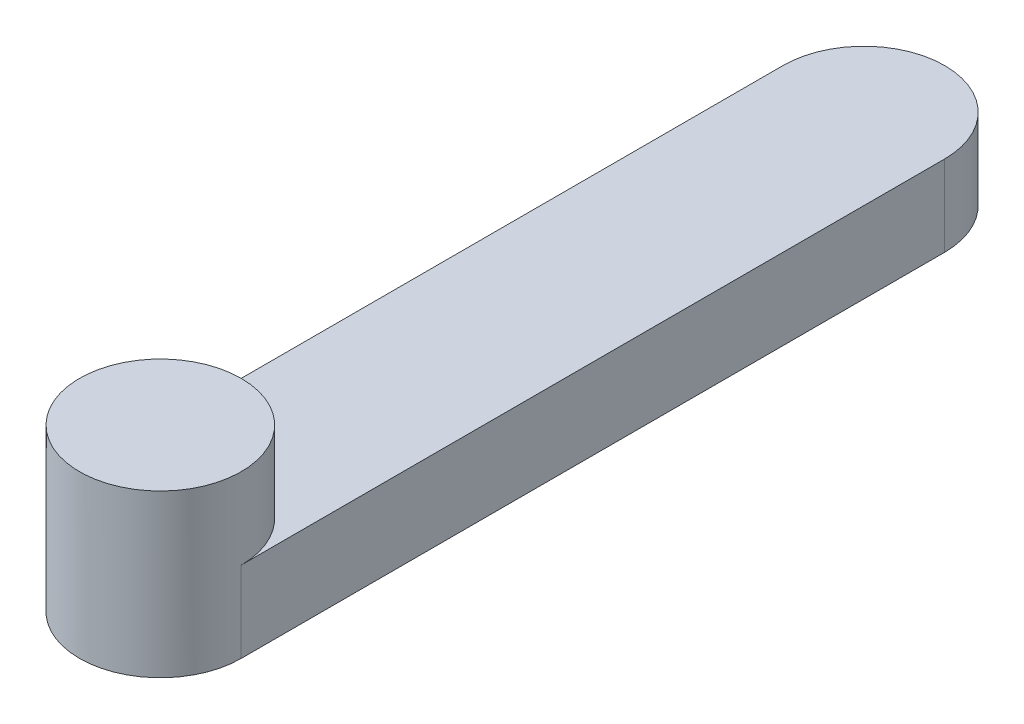
from build123d import *

# Parameters (mm, degrees)
BOSS_EXTRUDE1_DEPTH = 2.54
BOSS_EXTRUDE2_DEPTH = 2.54


with BuildPart() as part:
    # Sketch1 → Boss-Extrude1 (new body)
    with BuildSketch(Plane(origin=(0, 0, 0), x_dir=(1, 0, 0), z_dir=(0, 1, 0))):
        with BuildLine():
            Line((2.54, 0), (2.54, -22.098))
            ThreePointArc((2.54, -22.098), (0, -24.638), (-2.54, -22.098))
            Line((-2.54, -22.098), (-2.54, 0))
            ThreePointArc((-2.54, 0), (0, 2.54), (2.54, 0))
        make_face()
    extrude(amount=BOSS_EXTRUDE1_DEPTH)

    # Sketch2 → Boss-Extrude2 (add)
    with BuildSketch(Plane(origin=(0, 2.54, 0), x_dir=(1, 0, 0), z_dir=(0, 1, 0))):
        with BuildLine():
            ThreePointArc((-2.54, -22.098), (0, -24.638), (2.54, -22.098))
            ThreePointArc((2.54, -22.098), (0, -19.558), (-2.54, -22.098))
        make_face()
    extrude(amount=BOSS_EXTRUDE2_DEPTH)


solid = part.part
